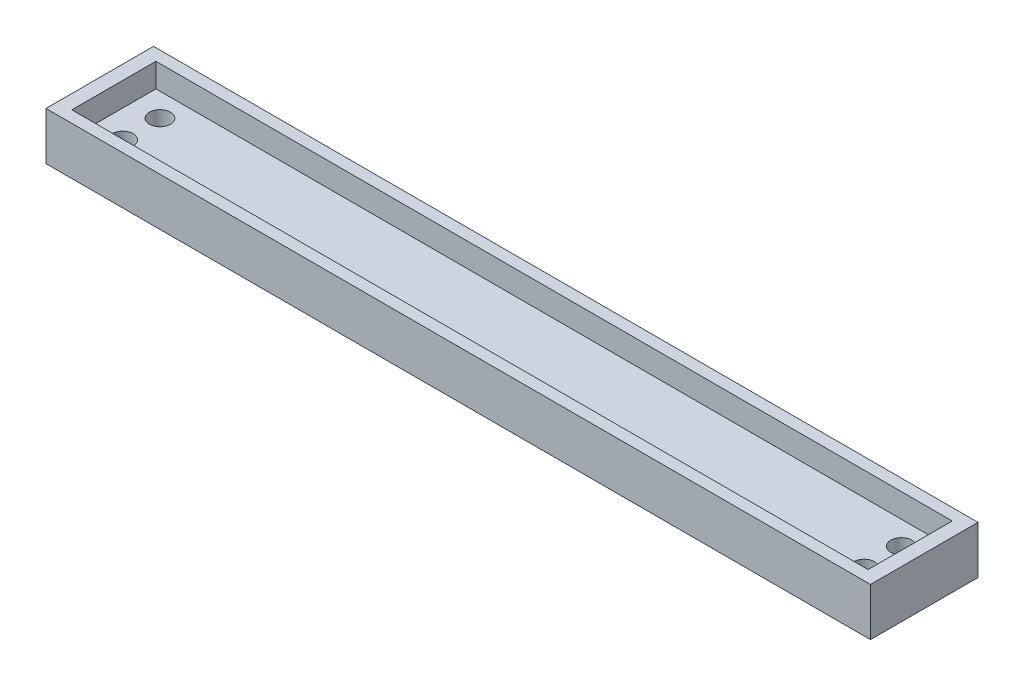
from build123d import *

# Parameters (mm, degrees)
SKETCH1_W           = 219.075
SKETCH1_H           = 28.575
BOSS_EXTRUDE1_DEPTH = 12.7
SKETCH2_W           = 211.582
SKETCH2_H           = 22.352
CUT_EXTRUDE1_DEPTH  = 6.35
SKETCH4_R           = 2.794
CUT_EXTRUDE2_DEPTH  = 222.021964406


with BuildPart() as part:
    # Sketch1 → Boss-Extrude1 (new body)
    with BuildSketch(Plane(origin=(0, 0, 0), x_dir=(1, 0, 0), z_dir=(0, 1, 0))):
        with Locations((109.5375, 14.2875)):
            Rectangle(SKETCH1_W, SKETCH1_H)
    extrude(amount=BOSS_EXTRUDE1_DEPTH)

    # Sketch2 → Cut-Extrude1 (cut)
    with BuildSketch(Plane(origin=(0, 12.7, 0), x_dir=(1, 0, 0), z_dir=(0, 1, 0))):
        with Locations((109.5375, 14.2875)):
            Rectangle(SKETCH2_W, SKETCH2_H)
    extrude(amount=-CUT_EXTRUDE1_DEPTH, mode=Mode.SUBTRACT)

    # Sketch4 → Cut-Extrude2 (cut, through all)
    with BuildSketch(Plane(origin=(0, 6.35, 0), x_dir=(1, 0, 0), z_dir=(0, 1, 0))):
        with Locations(Location((11.0363, 19.2405, 0), (0, 0, 270))):
            Circle(SKETCH4_R)
        with Locations(Location((11.0363, 9.3345, 0), (0, 0, 90))):
            Circle(SKETCH4_R)
        with Locations(Location((208.0387, 9.3345, 0), (0, 0, 270))):
            Circle(SKETCH4_R)
        with Locations(Location((208.0387, 19.2405, 0), (0, 0, 90))):
            Circle(SKETCH4_R)
    extrude(amount=-CUT_EXTRUDE2_DEPTH, mode=Mode.SUBTRACT)


solid = part.part
